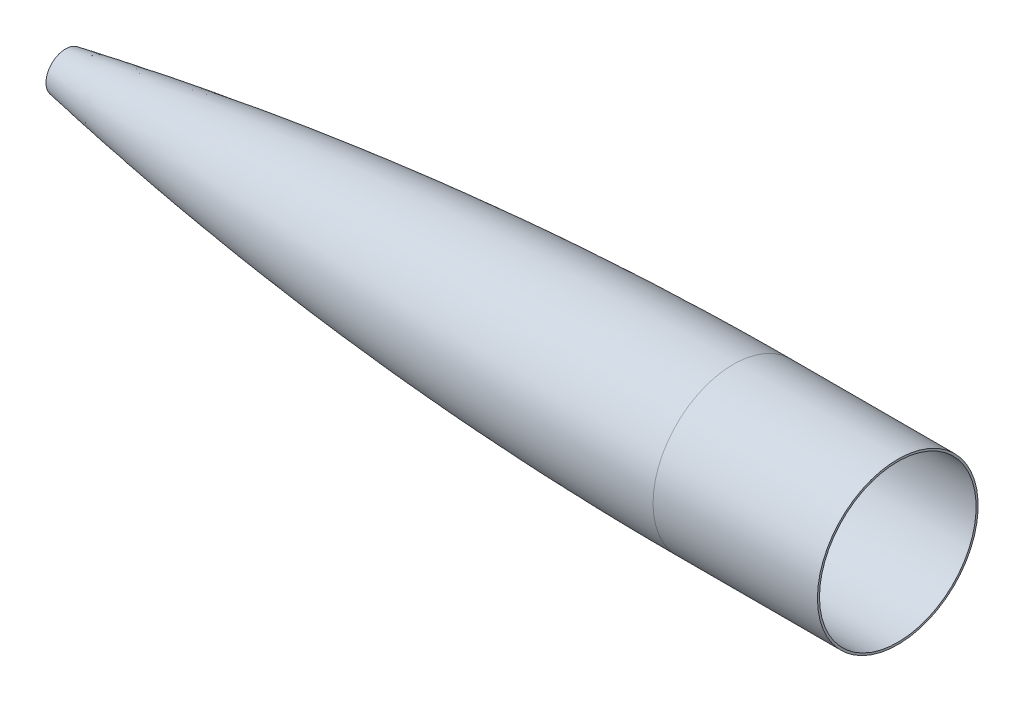
from build123d import *

# Parameters (mm, degrees)
SHELL1_T = -2


with BuildPart() as part:
    # Sketch3 → Revolve2 (revolve)
    with BuildSketch(Plane.XY, mode=Mode.PRIVATE) as revolve2_sk:
        with BuildLine():
            Line((100, 18.980275038), (100, 0))
            Line((100, 0), (909.941766762, 0))
            Line((909.941766762, 0), (909.941766762, 78.2))
            Line((909.941766762, 78.2), (749.941766762, 78.2))
            add(Edge.make_bspline(
                [(100, 18.980275038), (100.913198247, 19.147147871), (102.753257437, 19.482466892), (106.033221562, 20.078367186), (109.362490043, 20.679122289), (112.5998036, 21.260304196), (115.861710291, 21.843210265), (119.719521428, 22.528776475), (125.190409799, 23.493873415), (131.819133928, 24.652156558), (139.58997243, 25.993481176), (148.512205564, 27.510762017), (157.485070562, 29.01353812), (166.46251186, 30.494007326), (175.443135342, 31.951915886), (184.427673471, 33.387398793), (193.415599849, 34.800361147), (202.407139458, 36.190845496), (211.402067613, 37.558812365), (220.400428698, 38.90427159), (233.902945198, 40.888669877), (254.169064402, 43.780781547), (294.739285062, 49.294424586), (389.580060839, 60.81642158), (489.305434179, 69.651750851), (589.263170065, 75.154074643), (668.847358903, 77.274104215), (692.726759229, 77.710924271), (705.804444355, 77.890135533), (710.353297221, 77.945829443), (713.74042465, 77.98447421), (717.103075527, 78.020064461), (721.009948115, 78.057410067), (725.461793245, 78.094508363), (729.905925646, 78.126149655), (734.382362933, 78.152373466), (738.792712606, 78.173082482), (743.144962512, 78.188284577), (747.142871411, 78.196324463), (749.013447522, 78.199082165), (749.941766762, 78.2)],
                knots=[0.082785632, 0.082785632, 0.082785632, 0.082785632, 0.082785632, 0.088467655, 0.094149678, 0.09699069, 0.099831701, 0.105513724, 0.111195747, 0.11687777, 0.128241816, 0.139856232, 0.151470647, 0.163085063, 0.174699478, 0.186313894, 0.197928309, 0.209542725, 0.22115714, 0.232771556, 0.244385972, 0.256000387, 0.290843635, 0.337301298, 0.453445456, 0.743805848, 0.801877927, 0.84833559, 0.859950005, 0.865757213, 0.868660817, 0.871564421, 0.877246444, 0.882928466, 0.888610489, 0.894292511, 0.899974534, 0.905656556, 0.911338579, 0.917020601, 0.917020601, 0.917020601, 0.917020601, 0.917020601], degree=4))
        make_face()
    revolve(revolve2_sk.sketch.rotate(Axis((0, 0, 0), (1, 0, 0)), 90), axis=Axis((0, 0, 0), (1, 0, 0)))

    # Shell1
    shell1_openings = [part.faces().sort_by_distance(p)[0] for p in [
        (909.941766762, 0, 0),
    ]]
    offset(amount=SHELL1_T, openings=shell1_openings)


solid = part.part
